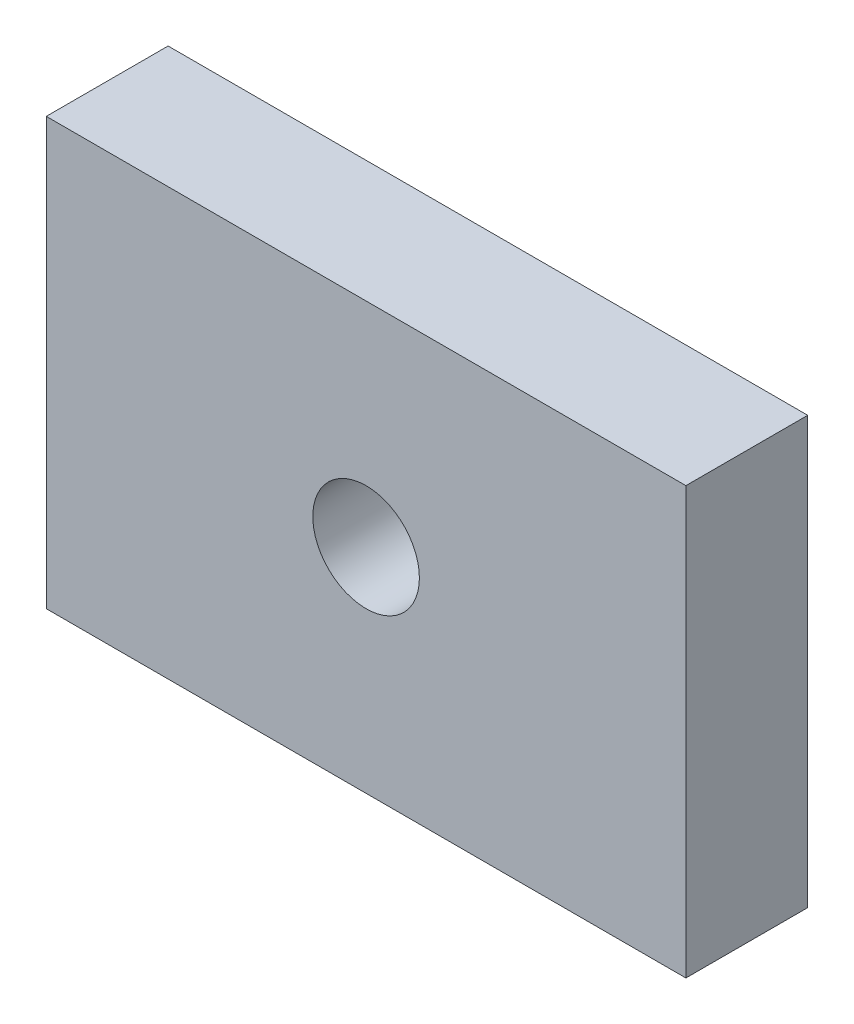
from build123d import *

# Parameters (mm, degrees)
SKIZZE1_W                       = 42
SKIZZE1_H                       = 28
SKIZZE1_R                       = 3.5
AUFSATZ_LINEAR_AUSTRAGEN1_DEPTH = 8
SKIZZE2_R                       = 1.6
SCHNITT_LINEAR_AUSTRAGEN1_DEPTH = 15
M4_GEWINDEBOHRUNG1_D            = 3.3
M4_GEWINDEBOHRUNG1_DEPTH        = 15
M4_GEWINDEBOHRUNG1_TIP          = 0.991420021


with BuildPart() as part:
    # Skizze1 → Aufsatz-Linear austragen1 (new body)
    with BuildSketch(Plane.XY):
        with Locations((0.646863863, -0.143442623)):
            Rectangle(SKIZZE1_W, SKIZZE1_H)
        with Locations((0.646863863, -0.143442623)):
            Circle(SKIZZE1_R, mode=Mode.SUBTRACT)
    extrude(amount=AUFSATZ_LINEAR_AUSTRAGEN1_DEPTH)

    # Skizze2 → Schnitt-Linear austragen1 (cut)
    with BuildSketch(Plane.ZY.offset(20.353136137)):
        with Locations(Location((4, 5.856557377, 0), (0, 0, 270))):
            Circle(SKIZZE2_R)
        with Locations(Location((4, -6.143442623, 0), (0, 0, 270))):
            Circle(SKIZZE2_R)
    extrude(amount=-SCHNITT_LINEAR_AUSTRAGEN1_DEPTH, mode=Mode.SUBTRACT)

    # M4 Gewindebohrung1
    with Locations(Plane(origin=(-20.353136137, -6.143442623, 4), x_dir=(0, -1, 0), z_dir=(-1, 0, 0))):
        with Locations((0, 0), (-12, 0)):
            Hole(M4_GEWINDEBOHRUNG1_D / 2, depth=M4_GEWINDEBOHRUNG1_DEPTH)
            with Locations((0, 0, -(M4_GEWINDEBOHRUNG1_DEPTH + M4_GEWINDEBOHRUNG1_TIP / 2))):  # 118° drill point
                Cone(0, M4_GEWINDEBOHRUNG1_D / 2, M4_GEWINDEBOHRUNG1_TIP, mode=Mode.SUBTRACT)


solid = part.part
